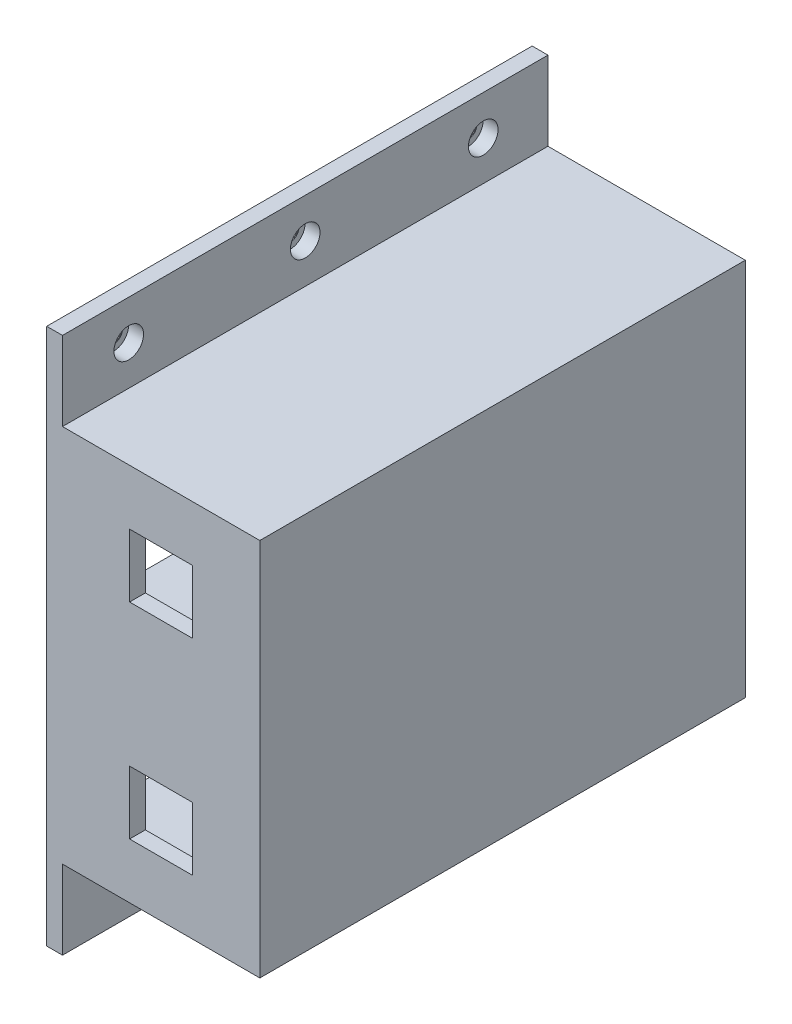
from build123d import *

# Parameters (mm, degrees)
SKETCH1_W                                       = 156.21
SKETCH1_H                                       = 25.4
BOSS_EXTRUDE1_DEPTH                             = 5.08
BOSS_EXTRUDE1_2_DEPTH                           = 5.08
SKETCH1_3_W                                     = 156.21
SKETCH1_3_H                                     = 121.92
SKETCH1_3_W_2                                   = 146.05
SKETCH1_3_H_2                                   = 53.34
BOSS_EXTRUDE2_DEPTH                             = 63.5
SKETCH2_W                                       = 156.21
SKETCH2_H                                       = 121.92
BOSS_EXTRUDE3_DEPTH                             = 5.08
SKETCH3_W                                       = 20.32
SKETCH3_H                                       = 20.32
CUT_EXTRUDE1_DEPTH                              = 5.08
CBORE_FOR_10_SOCKET_HEAD_CAP_SCREW1_D           = 5.6134
CBORE_FOR_10_SOCKET_HEAD_CAP_SCREW1_CBORE_D     = 9.525
CBORE_FOR_10_SOCKET_HEAD_CAP_SCREW1_CBORE_DEPTH = 4.826
CBORE_FOR_10_SOCKET_HEAD_CAP_SCREW2_D           = 5.6134
CBORE_FOR_10_SOCKET_HEAD_CAP_SCREW2_CBORE_D     = 9.525
CBORE_FOR_10_SOCKET_HEAD_CAP_SCREW2_CBORE_DEPTH = 4.826


with BuildPart() as part:
    # Sketch1 → Boss-Extrude1 (new body)
    with BuildSketch(Plane(origin=(0, 0, 0), x_dir=(0, 0, -1), z_dir=(1, 0, 0))):
        with Locations((0, 73.66)):
            Rectangle(SKETCH1_W, SKETCH1_H)
    extrude(amount=BOSS_EXTRUDE1_DEPTH)



with BuildPart() as body_2:
    # Sketch1 → Boss-Extrude1 2 (new body)
    with BuildSketch(Plane(origin=(0, 0, 0), x_dir=(0, 0, -1), z_dir=(1, 0, 0))):
        with Locations((0, -73.66)):
            Rectangle(SKETCH1_W, SKETCH1_H)
    extrude(amount=BOSS_EXTRUDE1_2_DEPTH)


with BuildPart() as part_1:
    add(part.part)

    add(body_2.part)  # Boss-Extrude2 merges body 2
    # Sketch1<3> → Boss-Extrude2 (add)
    with BuildSketch(Plane(origin=(0, 0, 0), x_dir=(0, 0, -1), z_dir=(1, 0, 0))):
        Rectangle(SKETCH1_3_W, SKETCH1_3_H)
        with Locations((0, -29.21)):
            Rectangle(SKETCH1_3_W_2, SKETCH1_3_H_2, mode=Mode.SUBTRACT)
        with Locations((0, 29.21)):
            Rectangle(SKETCH1_3_W_2, SKETCH1_3_H_2, mode=Mode.SUBTRACT)
    extrude(amount=BOSS_EXTRUDE2_DEPTH)

    # Sketch2 → Boss-Extrude3 (add)
    with BuildSketch(Plane(origin=(63.5, 0, 0), x_dir=(0, 0, -1), z_dir=(1, 0, 0))):
        Rectangle(SKETCH2_W, SKETCH2_H)
    extrude(amount=BOSS_EXTRUDE3_DEPTH)

    # Sketch3 → Cut-Extrude1 (cut)
    with BuildSketch(Plane.XY.offset(78.105)):
        with Locations((36.83, 33.02)):
            Rectangle(SKETCH3_W, SKETCH3_H)
        with Locations((36.83, -33.02)):
            Rectangle(SKETCH3_W, SKETCH3_H)
    extrude(amount=-CUT_EXTRUDE1_DEPTH, mode=Mode.SUBTRACT)

    # CBORE for #10 Socket Head Cap Screw1 (through all)
    with Locations(Plane(origin=(5.08, 0, 0), x_dir=(0, 0, -1), z_dir=(1, 0, 0))):
        with Locations((0, 73.66), (-56.783367635, 73.66), (57.284766025, 73.66)):
            CounterBoreHole(CBORE_FOR_10_SOCKET_HEAD_CAP_SCREW1_D / 2, CBORE_FOR_10_SOCKET_HEAD_CAP_SCREW1_CBORE_D / 2, CBORE_FOR_10_SOCKET_HEAD_CAP_SCREW1_CBORE_DEPTH)

    # CBORE for #10 Socket Head Cap Screw2 (through all)
    with Locations(Plane(origin=(5.08, 0, 0), x_dir=(0, 0, -1), z_dir=(1, 0, 0))):
        with Locations((0, -73.66), (-57.53546522, -73.66), (59.541058779, -73.66)):
            CounterBoreHole(CBORE_FOR_10_SOCKET_HEAD_CAP_SCREW2_D / 2, CBORE_FOR_10_SOCKET_HEAD_CAP_SCREW2_CBORE_D / 2, CBORE_FOR_10_SOCKET_HEAD_CAP_SCREW2_CBORE_DEPTH)


solid = part_1.part
